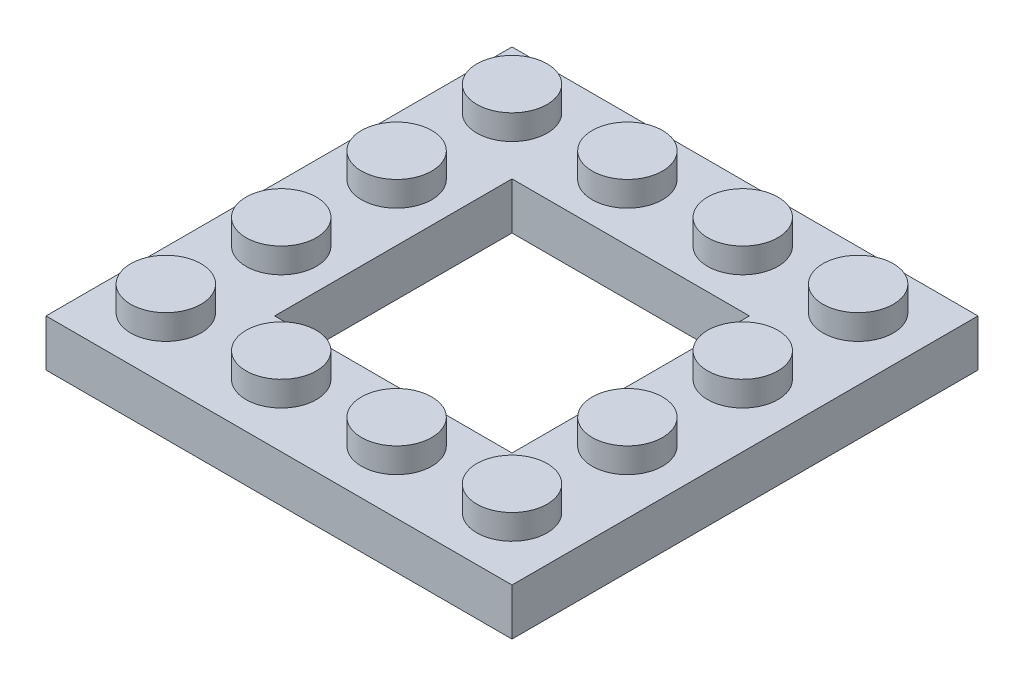
from build123d import *

# Parameters (mm, degrees)
SKETCH_1_W          = 31.8
SKETCH_1_H          = 31.8
EXTRUDE_1_DEPTH     = 3.2
SKETCH_2_W          = 16.2
SKETCH_2_H          = 16.2
CUT_EXTRUDE_3_DEPTH = 23.712551596
SKETCH_3_R          = 2.4
EXTRUDE_2_DEPTH     = 1.7
SKETCH_4_R          = 2.5
CUT_EXTRUDE_4_DEPTH = 1.8


with BuildPart() as part:
    # Эскиз1 → Бобышка-Вытянуть1 (new body)
    with BuildSketch(Plane(origin=(0, 0, 0), x_dir=(1, 0, 0), z_dir=(0, 1, 0))):
        Rectangle(SKETCH_1_W, SKETCH_1_H)
    extrude(amount=EXTRUDE_1_DEPTH)

    # Эскиз2 → Вырез-Вытянуть3 (cut, through all)
    with BuildSketch(Plane(origin=(0, 3.2, 0), x_dir=(1, 0, 0), z_dir=(0, 1, 0))):
        Rectangle(SKETCH_2_W, SKETCH_2_H)
    extrude(amount=-CUT_EXTRUDE_3_DEPTH, mode=Mode.SUBTRACT)

    # Эскиз3 → Бобышка-Вытянуть2 (add)
    with BuildSketch(Plane(origin=(0, 3.2, 0), x_dir=(1, 0, 0), z_dir=(0, 1, 0))):
        with Locations(Location((-12, 12, 0), (0, 0, 270))):
            Circle(SKETCH_3_R)
        with Locations(Location((-4.126, 12, 0), (0, 0, 270))):
            Circle(SKETCH_3_R)
        with Locations(Location((3.748, 12, 0), (0, 0, 270))):
            Circle(SKETCH_3_R)
        with Locations(Location((11.622, 12, 0), (0, 0, 270))):
            Circle(SKETCH_3_R)
        with Locations(Location((-12, 4.126, 0), (0, 0, 270))):
            Circle(SKETCH_3_R)
        with Locations(Location((-12, -3.748, 0), (0, 0, 270))):
            Circle(SKETCH_3_R)
        with Locations(Location((-12, -11.622, 0), (0, 0, 270))):
            Circle(SKETCH_3_R)
        with Locations(Location((-4.126, -11.622, 0), (0, 0, 270))):
            Circle(SKETCH_3_R)
        with Locations(Location((3.748, -11.622, 0), (0, 0, 270))):
            Circle(SKETCH_3_R)
        with Locations(Location((11.622, -11.622, 0), (0, 0, 270))):
            Circle(SKETCH_3_R)
        with Locations(Location((11.622, -3.748, 0), (0, 0, 270))):
            Circle(SKETCH_3_R)
        with Locations(Location((11.622, 4.126, 0), (0, 0, 270))):
            Circle(SKETCH_3_R)
    extrude(amount=EXTRUDE_2_DEPTH)

    # Эскиз4 → Вырез-Вытянуть4 (cut)
    with BuildSketch(Plane.XZ):
        with Locations(Location((-12, 12, 0), (0, 0, 270))):
            Circle(SKETCH_4_R)
        with Locations(Location((-4.126, 12, 0), (0, 0, 270))):
            Circle(SKETCH_4_R)
        with Locations(Location((3.748, 12, 0), (0, 0, 270))):
            Circle(SKETCH_4_R)
        with Locations(Location((11.622, 12, 0), (0, 0, 270))):
            Circle(SKETCH_4_R)
        with Locations(Location((-12, 4.126, 0), (0, 0, 270))):
            Circle(SKETCH_4_R)
        with Locations(Location((11.622, 4.126, 0), (0, 0, 270))):
            Circle(SKETCH_4_R)
        with Locations(Location((-12, -3.748, 0), (0, 0, 270))):
            Circle(SKETCH_4_R)
        with Locations(Location((11.622, -3.748, 0), (0, 0, 270))):
            Circle(SKETCH_4_R)
        with Locations(Location((-12, -11.622, 0), (0, 0, 270))):
            Circle(SKETCH_4_R)
        with Locations(Location((11.622, -11.622, 0), (0, 0, 270))):
            Circle(SKETCH_4_R)
        with Locations(Location((-4.126, -11.622, 0), (0, 0, 270))):
            Circle(SKETCH_4_R)
        with Locations(Location((3.748, -11.622, 0), (0, 0, 270))):
            Circle(SKETCH_4_R)
    extrude(amount=-CUT_EXTRUDE_4_DEPTH, mode=Mode.SUBTRACT)


solid = part.part
